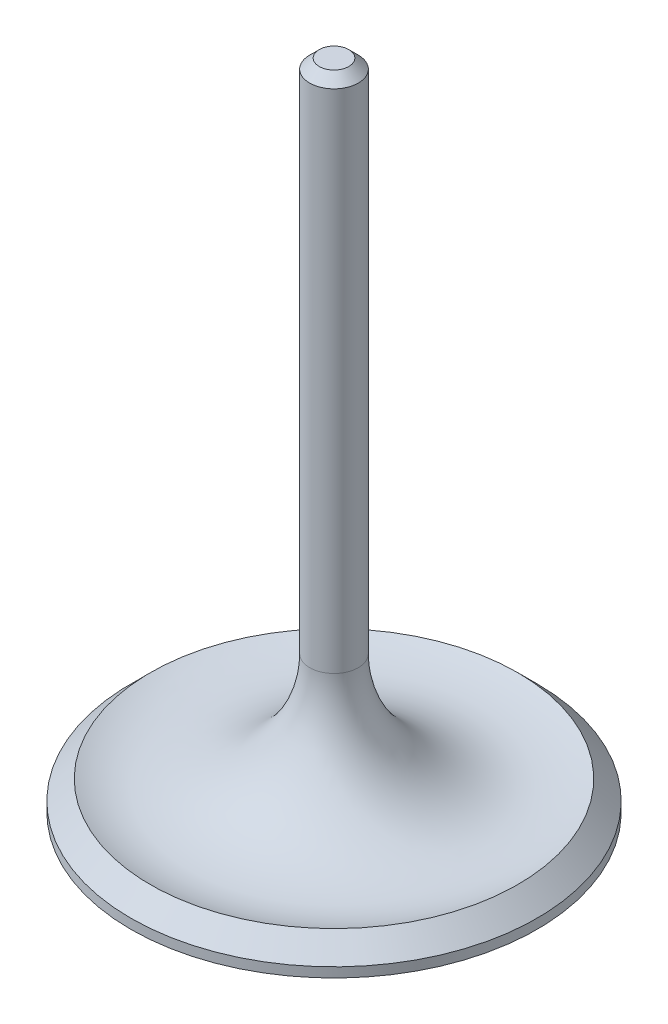
from build123d import *

# Parameters (mm, degrees)
CHAMFER1_SIZE = 1.25


with BuildPart() as part:
    # Sketch1 → Revolve1 (revolve)
    with BuildSketch(Plane.XY):
        with BuildLine():
            Line((0, 0), (26.6, 0))
            Line((26.6, 0), (26.6, 1.27))
            Line((26.6, 1.27), (24.06, 3.81))
            ThreePointArc((24.06, 3.81), (9.865392595, 5.364861657), (3.18, 17.982706164))
            Line((3.18, 17.982706164), (3.18, 85.55))
            Line((3.18, 85.55), (0, 85.55))
            Line((0, 85.55), (0, 0))
        make_face()
    revolve(axis=Axis((0, 0, 0), (0, 1, 0)))

    # Chamfer1
    chamfer1_edges = [part.edges().sort_by_distance(p)[0] for p in [
        (-3.18, 85.55, 0),
    ]]
    chamfer(chamfer1_edges, length=CHAMFER1_SIZE)


solid = part.part
